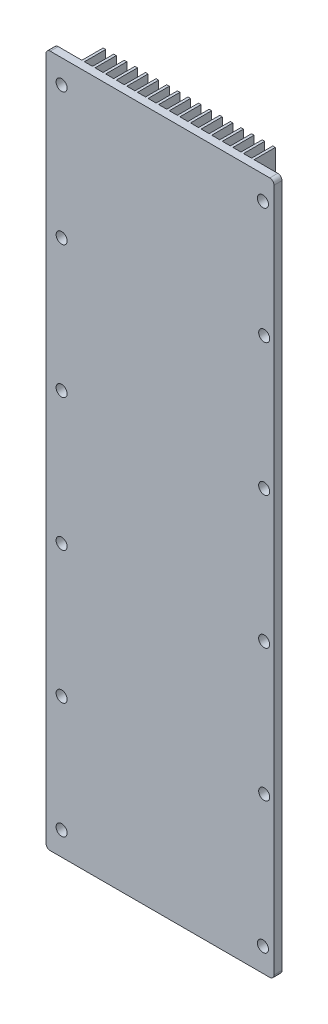
from build123d import *

# Parameters (mm, degrees)
BOSS_EXTRUDE1_DEPTH     = 431.8
SKETCH2_W               = 136.525
SKETCH2_H               = 4.7625
CUT_EXTRUDE1_DEPTH      = 455.272910918
SKETCH3_W               = 132.265960651
SKETCH3_H               = 13.462
CUT_EXTRUDE2_DEPTH      = 455.272910918
SKETCH4_W               = 11.600566843
SKETCH4_H               = 14.103653616
SKETCH4_W_2             = 12.2809
SKETCH4_H_2             = 14.918520238
CUT_EXTRUDE3_DEPTH      = 454.414011969
CUT_EXTRUDE4_DEPTH      = 454.047023636
CUT_EXTRUDE4_DEPTH_BACK = 454.047023636
SKETCH5_W               = 16.6878
SKETCH5_H               = 17.155999978
SKETCH5_W_2             = 119.8372
FILLET1_R               = 2.54
M6_CLEARANCE_HOLE2_D    = 6.6


with BuildPart() as part:
    # Sketch1 → Boss-Extrude1 (new body)
    with BuildSketch(Plane(origin=(0, 0, 0), x_dir=(1, 0, 0), z_dir=(0, 1, 0))):
        with BuildLine():
            Line((0, 0), (136.525, 0))
            Line((136.525, 0), (136.525, 9.525))
            Line((136.525, 9.525), (132.5372, 9.525))
            Line((132.5372, 9.525), (132.5372, 34.925))
            ThreePointArc((132.5372, 34.925), (131.7752, 35.687), (131.0132, 34.925))
            Line((131.0132, 34.925), (131.0132, 9.525))
            Line((131.0132, 9.525), (126.1872, 9.525))
            Line((126.1872, 9.525), (126.1872, 34.925))
            ThreePointArc((126.1872, 34.925), (125.4252, 35.687), (124.6632, 34.925))
            Line((124.6632, 34.925), (124.6632, 9.525))
            Line((124.6632, 9.525), (119.8372, 9.525))
            Line((119.8372, 9.525), (119.8372, 34.925))
            ThreePointArc((119.8372, 34.925), (119.0752, 35.687), (118.3132, 34.925))
            Line((118.3132, 34.925), (118.3132, 9.525))
            Line((118.3132, 9.525), (113.4872, 9.525))
            Line((113.4872, 9.525), (113.4872, 34.925))
            ThreePointArc((113.4872, 34.925), (112.7252, 35.687), (111.9632, 34.925))
            Line((111.9632, 34.925), (111.9632, 9.525))
            Line((111.9632, 9.525), (107.1372, 9.525))
            Line((107.1372, 9.525), (107.1372, 34.925))
            ThreePointArc((107.1372, 34.925), (106.3752, 35.687), (105.6132, 34.925))
            Line((105.6132, 34.925), (105.6132, 9.525))
            Line((105.6132, 9.525), (100.7872, 9.525))
            Line((100.7872, 9.525), (100.7872, 34.925))
            ThreePointArc((100.7872, 34.925), (100.0252, 35.687), (99.2632, 34.925))
            Line((99.2632, 34.925), (99.2632, 9.525))
            Line((99.2632, 9.525), (94.4372, 9.525))
            Line((94.4372, 9.525), (94.4372, 34.925))
            ThreePointArc((94.4372, 34.925), (93.6752, 35.687), (92.9132, 34.925))
            Line((92.9132, 34.925), (92.9132, 9.525))
            Line((92.9132, 9.525), (88.0872, 9.525))
            Line((88.0872, 9.525), (88.0872, 34.925))
            ThreePointArc((88.0872, 34.925), (87.3252, 35.687), (86.5632, 34.925))
            Line((86.5632, 34.925), (86.5632, 9.525))
            Line((86.5632, 9.525), (81.7372, 9.525))
            Line((81.7372, 9.525), (81.7372, 34.925))
            ThreePointArc((81.7372, 34.925), (80.9752, 35.687), (80.2132, 34.925))
            Line((80.2132, 34.925), (80.2132, 9.525))
            Line((80.2132, 9.525), (75.3872, 9.525))
            Line((75.3872, 9.525), (75.3872, 34.925))
            ThreePointArc((75.3872, 34.925), (74.6252, 35.687), (73.8632, 34.925))
            Line((73.8632, 34.925), (73.8632, 9.525))
            Line((73.8632, 9.525), (69.0372, 9.525))
            Line((69.0372, 9.525), (69.0372, 34.925))
            ThreePointArc((69.0372, 34.925), (68.2752, 35.687), (67.5132, 34.925))
            Line((67.5132, 34.925), (67.5132, 9.525))
            Line((67.5132, 9.525), (62.6872, 9.525))
            Line((62.6872, 9.525), (62.6872, 34.925))
            ThreePointArc((62.6872, 34.925), (61.9252, 35.687), (61.1632, 34.925))
            Line((61.1632, 34.925), (61.1632, 9.525))
            Line((61.1632, 9.525), (56.3372, 9.525))
            Line((56.3372, 9.525), (56.3372, 34.925))
            ThreePointArc((56.3372, 34.925), (55.5752, 35.687), (54.8132, 34.925))
            Line((54.8132, 34.925), (54.8132, 9.525))
            Line((54.8132, 9.525), (49.9872, 9.525))
            Line((49.9872, 9.525), (49.9872, 34.925))
            ThreePointArc((49.9872, 34.925), (49.2252, 35.687), (48.4632, 34.925))
            Line((48.4632, 34.925), (48.4632, 9.525))
            Line((48.4632, 9.525), (43.6372, 9.525))
            Line((43.6372, 9.525), (43.6372, 34.925))
            ThreePointArc((43.6372, 34.925), (42.8752, 35.687), (42.1132, 34.925))
            Line((42.1132, 34.925), (42.1132, 9.525))
            Line((42.1132, 9.525), (37.2872, 9.525))
            Line((37.2872, 9.525), (37.2872, 34.925))
            ThreePointArc((37.2872, 34.925), (36.5252, 35.687), (35.7632, 34.925))
            Line((35.7632, 34.925), (35.7632, 9.525))
            Line((35.7632, 9.525), (30.9372, 9.525))
            Line((30.9372, 9.525), (30.9372, 34.925))
            ThreePointArc((30.9372, 34.925), (30.1752, 35.687), (29.4132, 34.925))
            Line((29.4132, 34.925), (29.4132, 9.525))
            Line((29.4132, 9.525), (24.5872, 9.525))
            Line((24.5872, 9.525), (24.5872, 34.925))
            ThreePointArc((24.5872, 34.925), (23.8252, 35.687), (23.0632, 34.925))
            Line((23.0632, 34.925), (23.0632, 9.525))
            Line((23.0632, 9.525), (18.2372, 9.525))
            Line((18.2372, 9.525), (18.2372, 34.925))
            ThreePointArc((18.2372, 34.925), (17.4752, 35.687), (16.7132, 34.925))
            Line((16.7132, 34.925), (16.7132, 9.525))
            Line((16.7132, 9.525), (11.8872, 9.525))
            Line((11.8872, 9.525), (11.8872, 34.925))
            ThreePointArc((11.8872, 34.925), (11.1252, 35.687), (10.3632, 34.925))
            Line((10.3632, 34.925), (10.3632, 9.525))
            Line((10.3632, 9.525), (5.5372, 9.525))
            Line((5.5372, 9.525), (5.5372, 34.925))
            ThreePointArc((5.5372, 34.925), (4.7752, 35.687), (4.0132, 34.925))
            Line((4.0132, 34.925), (4.0132, 9.525))
            Line((4.0132, 9.525), (0, 9.525))
            Line((0, 9.525), (0, 0))
        make_face()
    extrude(amount=BOSS_EXTRUDE1_DEPTH)

    # Sketch2 → Cut-Extrude1 (cut, through all)
    with BuildSketch(Plane(origin=(0, 431.8, 0), x_dir=(1, 0, 0), z_dir=(0, 1, 0))):
        with Locations((68.2625, 2.38125)):
            Rectangle(SKETCH2_W, SKETCH2_H)
    extrude(amount=-CUT_EXTRUDE1_DEPTH, mode=Mode.SUBTRACT)

    # Sketch3 → Cut-Extrude2 (cut, through all)
    with BuildSketch(Plane.XZ):
        with Locations((69.2831702, -28.956)):
            Rectangle(SKETCH3_W, SKETCH3_H)
    extrude(amount=-CUT_EXTRUDE2_DEPTH, mode=Mode.SUBTRACT)

    # Sketch4 → Cut-Extrude3 (cut, through all)
    with BuildSketch(Plane(origin=(0, 431.8, 0), x_dir=(1, 0, 0), z_dir=(0, 1, 0))):
        with Locations((7.806883422, 16.576826808)):
            Rectangle(SKETCH4_W, SKETCH4_H)
        with Locations((128.39065, 16.984260119)):
            Rectangle(SKETCH4_W_2, SKETCH4_H_2)
    extrude(amount=-CUT_EXTRUDE3_DEPTH, mode=Mode.SUBTRACT)

    # Sketch5 → Cut-Extrude4 (cut, two sides: drawn at the far end of the back side and taken through both)
    with BuildSketch(Plane(origin=(0, 0, -9.525), x_dir=(-1, 0, 0), z_dir=(0, 0, -1)).offset(-CUT_EXTRUDE4_DEPTH_BACK)):
        with Locations((-128.1811, 8.577999989)):
            Rectangle(SKETCH5_W, SKETCH5_H)
        with Locations((-59.9186, 8.577999989)):
            Rectangle(SKETCH5_W_2, SKETCH5_H)
    extrude(amount=CUT_EXTRUDE4_DEPTH + CUT_EXTRUDE4_DEPTH_BACK, mode=Mode.SUBTRACT)

    # Fillet1
    fillet1_edges = [part.edges().sort_by_distance(p)[0] for p in [
        (136.525, 431.8, -7.14375),
        (0, 431.8, -7.14375),
        (0, 17.155999978, -7.14375),
        (136.525, 17.155999978, -7.14375),
    ]]
    fillet(fillet1_edges, radius=FILLET1_R)

    # M6 Clearance Hole2 (through all)
    with Locations(Plane.XY.offset(-4.7625)):
        with Locations((9.324759355, 31.310999989), (129.902965514, 31.310999989), (130.630936095, 110.558999989), (9.324759355, 100.652999989), (9.324759355, 179.900999989), (130.630936095, 189.806999989), (9.324759355, 259.148999989), (130.630936095, 269.054999989), (130.630936095, 348.302999989), (9.324759355, 338.396999989), (9.324759355, 417.644999989), (129.902965514, 417.644999989)):
            Hole(M6_CLEARANCE_HOLE2_D / 2)


solid = part.part
